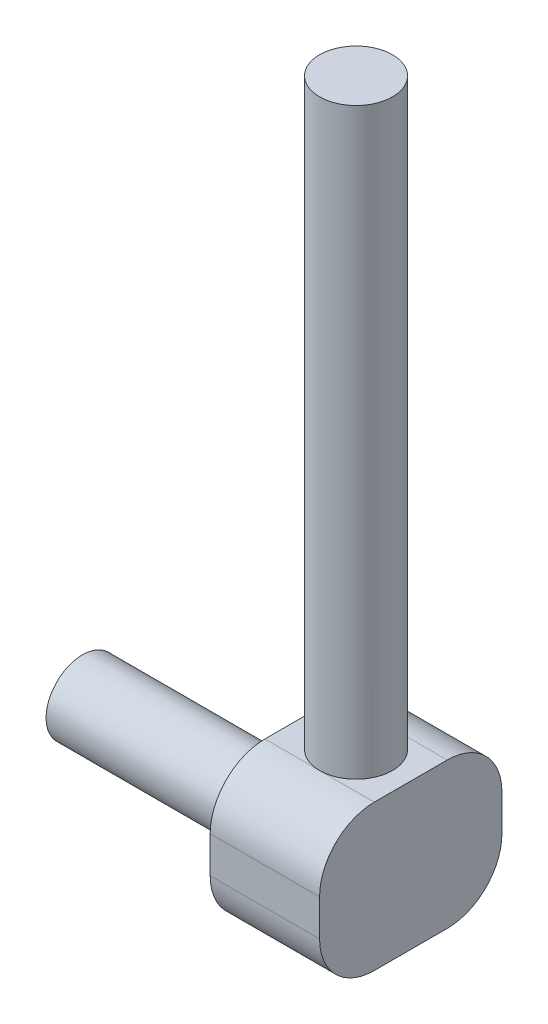
from build123d import *

# Parameters (mm, degrees)
SKETCH_1_R           = 10
EXTRUDE_1_DEPTH      = 200
EXTRUDE_2_DEPTH      = 15
EXTRUDE_2_DEPTH_BACK = 15
SKETCH_4_R           = 10
EXTRUDE_3_DEPTH      = 60


with BuildPart() as part:
    # 草图1 → 凸台-拉伸1 (new body)
    with BuildSketch(Plane(origin=(0, 0, 0), x_dir=(1, 0, 0), z_dir=(0, 1, 0))):
        Circle(SKETCH_1_R)
    extrude(amount=EXTRUDE_1_DEPTH)

    # 草图2 → 凸台-拉伸2 (add, two sides: drawn at the far end of the back side and taken through both)
    with BuildSketch(Plane(origin=(0, 0, 0), x_dir=(0, 0, -1), z_dir=(1, 0, 0)).offset(-EXTRUDE_2_DEPTH_BACK)):
        with BuildLine():
            Line((-10, 40), (10, 40))
            ThreePointArc((10, 40), (20.606601718, 35.606601718), (25, 25))
            Line((25, 25), (25, 15))
            ThreePointArc((25, 15), (20.606601718, 4.393398282), (10, 0))
            Line((10, 0), (-10, 0))
            ThreePointArc((-10, 0), (-20.606601718, 4.393398282), (-25, 15))
            Line((-25, 15), (-25, 25))
            ThreePointArc((-25, 25), (-20.606601718, 35.606601718), (-10, 40))
        make_face()
    extrude(amount=EXTRUDE_2_DEPTH + EXTRUDE_2_DEPTH_BACK)

    # 草图4 → 凸台-拉伸3 (add)
    with BuildSketch(Plane.ZY.offset(15)):
        with Locations((0, 15)):
            Circle(SKETCH_4_R)
    extrude(amount=EXTRUDE_3_DEPTH)


solid = part.part
